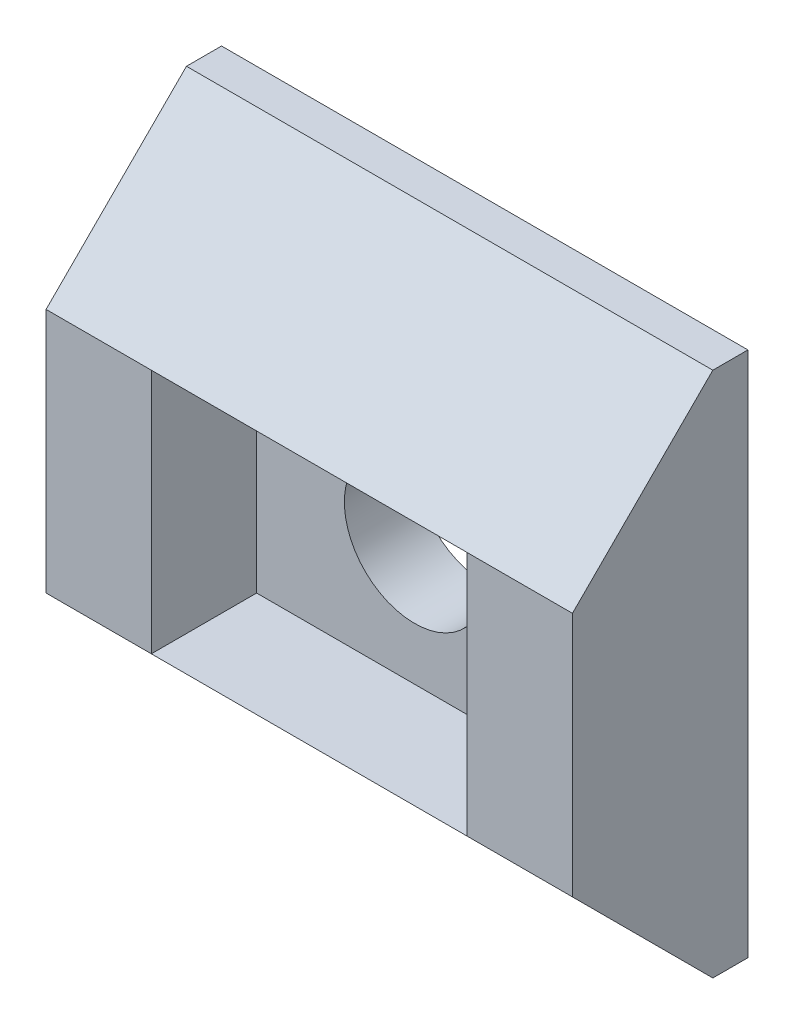
from build123d import *

# Parameters (mm, degrees)
SKETCH1_W           = 15
SKETCH1_H           = 15
BOSS_EXTRUDE1_DEPTH = 5
CUT_EXTRUDE1_DEPTH  = 18.5
SKETCH3_R           = 2
CUT_EXTRUDE2_DEPTH  = 12.7260394
SKETCH4_W           = 9
SKETCH4_H           = 7
CUT_EXTRUDE4_DEPTH  = 3


with BuildPart() as part:
    # Sketch1 → Boss-Extrude1 (new body)
    with BuildSketch(Plane.XY):
        Rectangle(SKETCH1_W, SKETCH1_H)
    extrude(amount=BOSS_EXTRUDE1_DEPTH)

    # Sketch2 → Cut-Extrude1 (cut, through all)
    with BuildSketch(Plane.ZY.offset(7.5)):
        Polygon((1, 7.5), (5, 3.5), (5, 7.5), align=None)
        Polygon((1, -7.5), (5, -3.5), (5, -7.5), align=None)
    extrude(amount=-CUT_EXTRUDE1_DEPTH, mode=Mode.SUBTRACT)

    # Sketch3 → Cut-Extrude2 (cut, through all)
    with BuildSketch(Plane.XY.offset(5)):
        Circle(SKETCH3_R)
    extrude(amount=-CUT_EXTRUDE2_DEPTH, mode=Mode.SUBTRACT)

    # Sketch4 → Cut-Extrude4 (cut)
    with BuildSketch(Plane.XY.offset(5)):
        Rectangle(SKETCH4_W, SKETCH4_H)
    extrude(amount=-CUT_EXTRUDE4_DEPTH, mode=Mode.SUBTRACT)


solid = part.part
